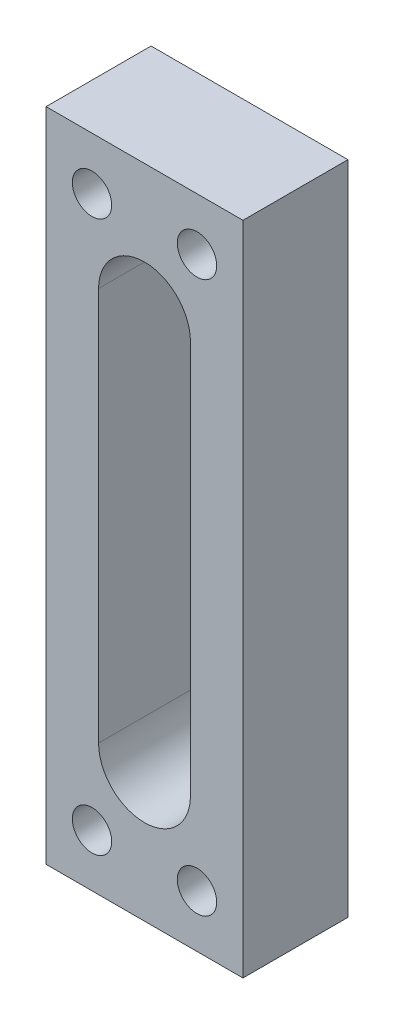
from build123d import *

# Parameters (mm, degrees)
SKETCH_1_W          = 15
SKETCH_1_H          = 50
EXTRUDE_1_DEPTH     = 8
SKETCH_2_R          = 1.5
CUT_EXTRUDE_1_DEPTH = 28.299267389
CUT_EXTRUDE_3_DEPTH = 28.299267389


with BuildPart() as part:
    # 草图1 → 凸台-拉伸1 (new body)
    with BuildSketch(Plane.XY):
        Rectangle(SKETCH_1_W, SKETCH_1_H)
    extrude(amount=EXTRUDE_1_DEPTH)

    # 草图2 → 切除-拉伸1 (cut, through all)
    with BuildSketch(Plane.XY.offset(8)):
        with Locations((-4, 21)):
            Circle(SKETCH_2_R)
        with Locations((4, 21)):
            Circle(SKETCH_2_R)
        with Locations((4, -21)):
            Circle(SKETCH_2_R)
        with Locations((-4, -21)):
            Circle(SKETCH_2_R)
    extrude(amount=-CUT_EXTRUDE_1_DEPTH, mode=Mode.SUBTRACT)

    # 草图3 → 切除-拉伸3 (cut, through all)
    with BuildSketch(Plane.XY.offset(8)):
        with BuildLine():
            Line((3.5, 15), (3.5, -15))
            ThreePointArc((3.5, -15), (0, -18.5), (-3.5, -15))
            Line((-3.5, -15), (-3.5, 15))
            ThreePointArc((-3.5, 15), (0, 18.5), (3.5, 15))
        make_face()
    extrude(amount=-CUT_EXTRUDE_3_DEPTH, mode=Mode.SUBTRACT)


solid = part.part
